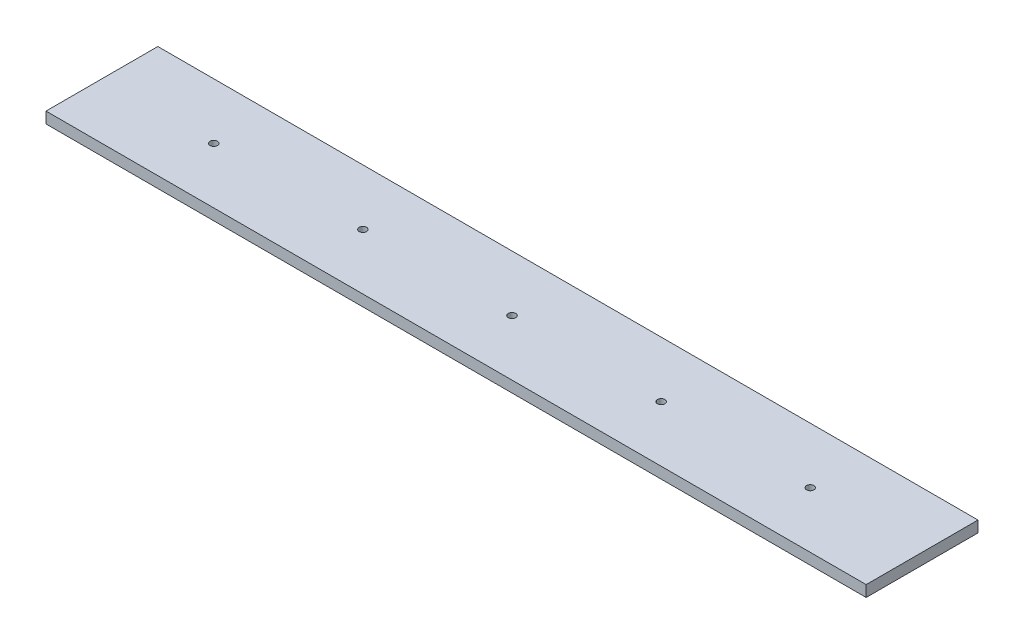
from build123d import *

# Parameters (mm, degrees)
SKETCH1_W           = 220
SKETCH1_H           = 30
SKETCH1_R           = 1
BOSS_EXTRUDE1_DEPTH = 3


with BuildPart() as part:
    # Sketch1 → Boss-Extrude1 (new body)
    with BuildSketch(Plane(origin=(0, 0, 0), x_dir=(1, 0, 0), z_dir=(0, 1, 0))):
        with Locations((30, 2.5)):
            Rectangle(SKETCH1_W, SKETCH1_H)
        with Locations(Location((-50, 2.5, 0), (0, 0, 270))):
            Circle(SKETCH1_R, mode=Mode.SUBTRACT)
        with Locations(Location((-10, 2.5, 0), (0, 0, 270))):
            Circle(SKETCH1_R, mode=Mode.SUBTRACT)
        with Locations(Location((30, 2.5, 0), (0, 0, 270))):
            Circle(SKETCH1_R, mode=Mode.SUBTRACT)
        with Locations(Location((70, 2.5, 0), (0, 0, 270))):
            Circle(SKETCH1_R, mode=Mode.SUBTRACT)
        with Locations(Location((110, 2.5, 0), (0, 0, 270))):
            Circle(SKETCH1_R, mode=Mode.SUBTRACT)
    extrude(amount=BOSS_EXTRUDE1_DEPTH)


solid = part.part
